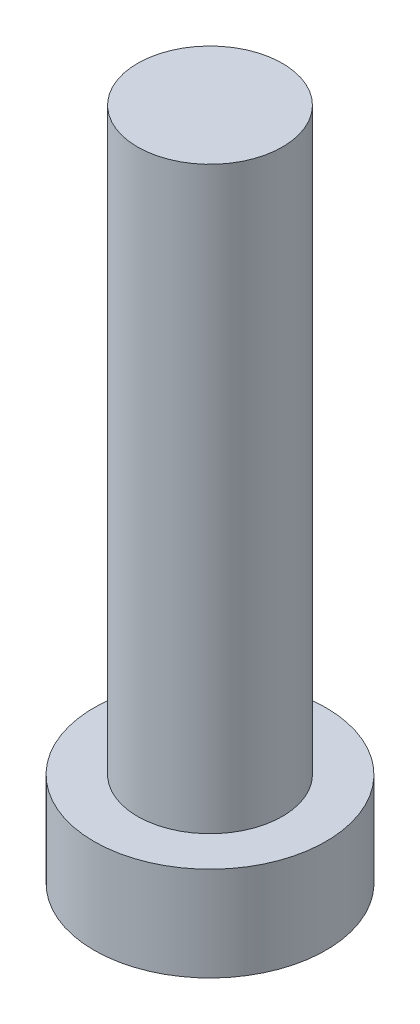
from build123d import *

# Parameters (mm, degrees)
SKETCH_1_R      = 1.6
EXTRUDE_1_DEPTH = 1.3
SKETCH_2_R      = 1
EXTRUDE_2_DEPTH = 8


with BuildPart() as part:
    # 草图1 → 凸台-拉伸1 (new body)
    with BuildSketch(Plane(origin=(0, 0, 0), x_dir=(1, 0, 0), z_dir=(0, 1, 0))):
        with Locations(Location((0, 0, 0), (0, 0, 270))):
            Circle(SKETCH_1_R)
    extrude(amount=EXTRUDE_1_DEPTH)

    # 草图2 → 凸台-拉伸2 (add)
    with BuildSketch(Plane(origin=(0, 1.3, 0), x_dir=(1, 0, 0), z_dir=(0, 1, 0))):
        with Locations(Location((0, 0, 0), (0, 0, 270))):
            Circle(SKETCH_2_R)
    extrude(amount=EXTRUDE_2_DEPTH)


solid = part.part
